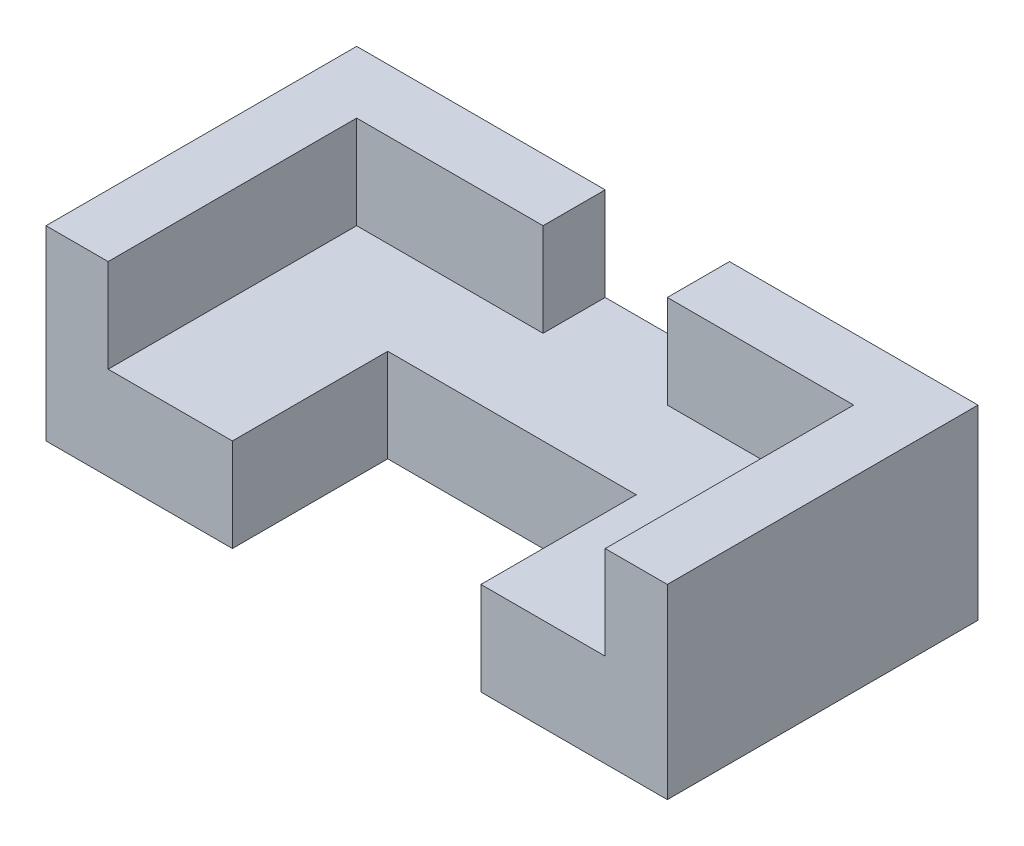
from build123d import *

# Parameters (mm, degrees)
BOSS_EXTRUDE1_DEPTH   = 50
BOSS_EXTRUDE1_2_DEPTH = 50
BOSS_EXTRUDE2_DEPTH   = 25
SKETCH1_4_W           = 30
SKETCH1_4_H           = 15
BOSS_EXTRUDE3_DEPTH   = 10


with BuildPart() as part:
    # Sketch1 → Boss-Extrude1 (new body)
    with BuildSketch(Plane.XY):
        Polygon((10, 15), (10, 30), (0, 30), (0, 0), (30, 0), (30, 15), align=None)
    extrude(amount=BOSS_EXTRUDE1_DEPTH)



with BuildPart() as body_2:
    # Sketch1 → Boss-Extrude1 2 (new body)
    with BuildSketch(Plane.XY):
        Polygon((100, 30), (90, 30), (90, 15), (70, 15), (70, 0), (100, 0), align=None)
    extrude(amount=BOSS_EXTRUDE1_2_DEPTH)


with BuildPart() as part_1:
    add(part.part)

    add(body_2.part)  # Boss-Extrude2 merges body 2
    # Sketch1<3> → Boss-Extrude2 (add)
    with BuildSketch(Plane.XY):
        Polygon((40, 15), (30, 15), (30, 0), (70, 0), (70, 15), (60, 15), align=None)
    extrude(amount=BOSS_EXTRUDE2_DEPTH)

    # Sketch1<4> → Boss-Extrude3 (add)
    with BuildSketch(Plane.XY):
        with Locations((25, 22.5)):
            Rectangle(SKETCH1_4_W, SKETCH1_4_H)
        with Locations((75, 22.5)):
            Rectangle(SKETCH1_4_W, SKETCH1_4_H)
    extrude(amount=BOSS_EXTRUDE3_DEPTH)


solid = part_1.part
